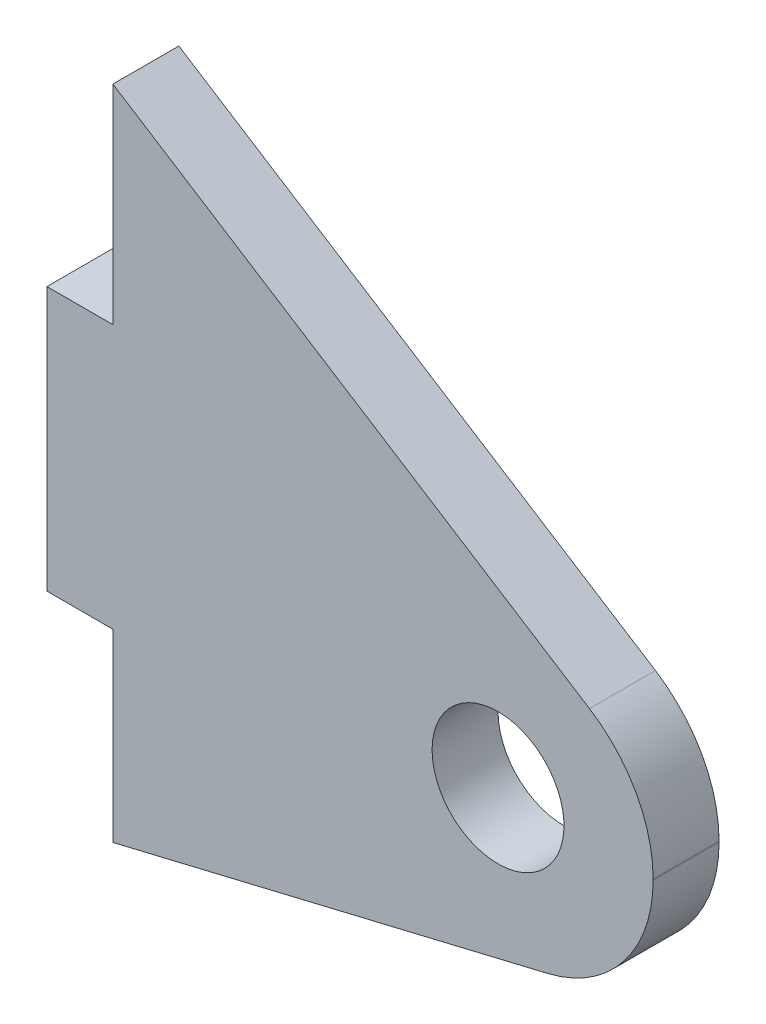
from build123d import *

# Parameters (mm, degrees)
SKETCH1_W                   = 68.548183611
SKETCH1_H                   = 64.912098736
BOSS_EXTRUDE1_DEPTH         = 3.175
F_1_4_0_25_DIAMETER_HOLE1_D = 6.35
CUT_EXTRUDE1_DEPTH          = 95.459063428
FILLET1_R                   = 6.604
SKETCH5_W                   = 3.175
SKETCH5_H                   = 12.7
BOSS_EXTRUDE2_DEPTH         = 3.175


with BuildPart() as part:
    # Sketch1 → Boss-Extrude1 (new body)
    with BuildSketch(Plane.XY):
        with Locations((34.274091805, 32.456049368)):
            Rectangle(SKETCH1_W, SKETCH1_H)
    extrude(amount=BOSS_EXTRUDE1_DEPTH)

    # 1/4 (0.25) Diameter Hole1 (through all)
    with Locations(Plane(origin=(0, 0, 0), x_dir=(-1, 0, 0), z_dir=(0, 0, -1))):
        with Locations((-18.542, 44.846098736)):
            Hole(F_1_4_0_25_DIAMETER_HOLE1_D / 2)

    # Sketch4 → Cut-Extrude1 (cut, through all)
    with BuildSketch(Plane(origin=(0, 0, 0), x_dir=(-1, 0, 0), z_dir=(0, 0, -1))):
        Polygon((-26.0096, 48.402098736), (0, 64.912098736), (-68.548183611, 64.912098736), (-68.548183611, 0), (0, 0), (0, 33.293092607), (-26.0096, 39.512098736), align=None)
    extrude(amount=-CUT_EXTRUDE1_DEPTH, mode=Mode.SUBTRACT)

    # Fillet1
    fillet1_edges = [part.edges().sort_by_distance(p)[0] for p in [
        (26.0096, 39.512098736, 1.5875),
        (26.0096, 48.402098736, 1.5875),
    ]]
    fillet(fillet1_edges, radius=FILLET1_R)

    # Sketch5 → Boss-Extrude2 (add)
    with BuildSketch(Plane(origin=(0, 0, 0), x_dir=(-1, 0, 0), z_dir=(0, 0, -1))):
        with Locations((1.5875, 48.533092607)):
            Rectangle(SKETCH5_W, SKETCH5_H)
    extrude(amount=-BOSS_EXTRUDE2_DEPTH)


solid = part.part
